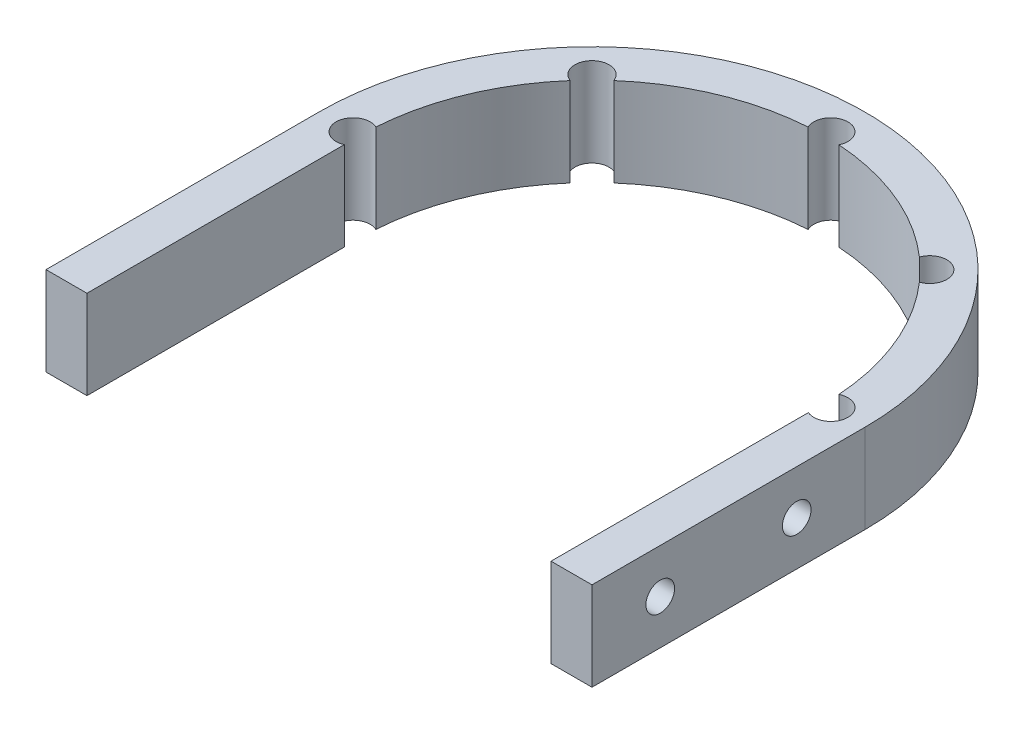
from build123d import *

# Parameters (mm, degrees)
SKETCH_1_R          = 34
EXTRUDE_1_DEPTH     = 13
SKETCH_2_R          = 2.5
CUT_EXTRUDE_1_DEPTH = 59.043087444
SKETCH_3_W          = 68
SKETCH_3_H          = 40
CUT_EXTRUDE_2_DEPTH = 59.043087444
SKETCH_4_R          = 2.1
CUT_EXTRUDE_3_DEPTH = 4


with BuildPart() as part:
    # 草图1 → 凸台-拉伸1 (new body)
    with BuildSketch(Plane(origin=(0, 0, 0), x_dir=(1, 0, 0), z_dir=(0, 1, 0))):
        with BuildLine():
            Line((-40, 0), (-40, -40))
            Line((-40, -40), (40, -40))
            Line((40, -40), (40, 0))
            ThreePointArc((40, 0), (0, 40), (-40, 0))
        make_face()
        with Locations(Location((0, 0, 0), (0, 0, 90))):
            Circle(SKETCH_1_R, mode=Mode.SUBTRACT)
    extrude(amount=EXTRUDE_1_DEPTH)

    # 草图2 → 切除-拉伸1 (cut, through all)
    with BuildSketch(Plane(origin=(0, 13, 0), x_dir=(1, 0, 0), z_dir=(0, 1, 0))):
        with Locations((0, 35)):
            Circle(SKETCH_2_R)
        with Locations((24.748737342, 24.748737342)):
            Circle(SKETCH_2_R)
        with Locations((35, 0)):
            Circle(SKETCH_2_R)
        with Locations((24.748737342, -24.748737342)):
            Circle(SKETCH_2_R)
        with Locations((0, -35)):
            Circle(SKETCH_2_R)
        with Locations((-24.748737342, -24.748737342)):
            Circle(SKETCH_2_R)
        with Locations((-35, 0)):
            Circle(SKETCH_2_R)
        with Locations((-24.748737342, 24.748737342)):
            Circle(SKETCH_2_R)
    extrude(amount=-CUT_EXTRUDE_1_DEPTH, mode=Mode.SUBTRACT)

    # 草图3 → 切除-拉伸2 (cut, through all)
    with BuildSketch(Plane(origin=(0, 13, 0), x_dir=(1, 0, 0), z_dir=(0, 1, 0))):
        with Locations((0, -20)):
            Rectangle(SKETCH_3_W, SKETCH_3_H)
    extrude(amount=-CUT_EXTRUDE_2_DEPTH, mode=Mode.SUBTRACT)

    # 草图4 → 切除-拉伸3 (cut)
    with BuildSketch(Plane.ZY.offset(40)):
        with Locations((10, 6.5)):
            Circle(SKETCH_4_R)
        with Locations((30, 6.5)):
            Circle(SKETCH_4_R)
    cut_extrude_3 = extrude(amount=-CUT_EXTRUDE_3_DEPTH, mode=Mode.SUBTRACT)

    # 镜向1: 切除-拉伸3 across plane
    add(cut_extrude_3.mirror(Plane.ZY), mode=Mode.SUBTRACT)


solid = part.part
